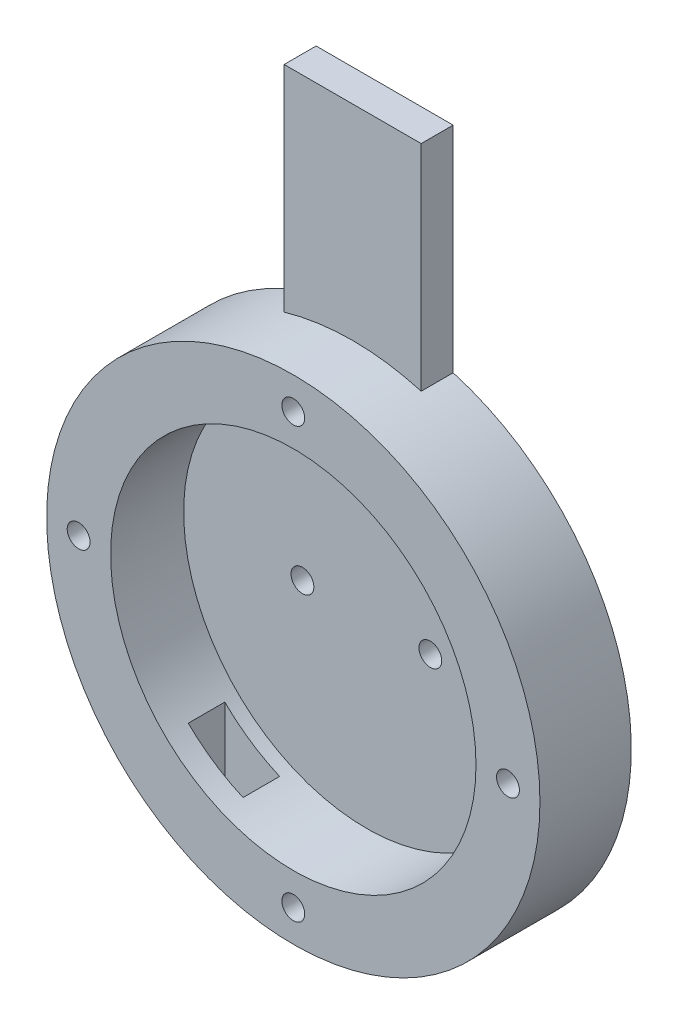
from build123d import *

# Parameters (mm, degrees)
SKETCH1_R               = 27
SKETCH1_R_2             = 1.25
SKETCH1_R_3             = 20
BOSS_EXTRUDE1_DEPTH     = 10
SKETCH3_R               = 20
SKETCH3_R_2             = 1.25
BOSS_EXTRUDE2_DEPTH     = 2
SKETCH5_W               = 15
SKETCH5_H               = 24.16646527
BOSS_EXTRUDE3_DEPTH     = 3.5
CUT_EXTRUDE1_REACH      = 59.191
CUT_EXTRUDE1_END_RADIUS = 27
SKETCH4_W               = 6
SKETCH4_H               = 4


with BuildPart() as part:
    # Sketch1 → Boss-Extrude1 (new body)
    with BuildSketch(Plane.XY):
        Circle(SKETCH1_R)
        with Locations((0, 23.5)):
            Circle(SKETCH1_R_2, mode=Mode.SUBTRACT)
        with Locations((23.5, 0)):
            Circle(SKETCH1_R_2, mode=Mode.SUBTRACT)
        with Locations((0, -23.5)):
            Circle(SKETCH1_R_2, mode=Mode.SUBTRACT)
        with Locations((-23.5, 0)):
            Circle(SKETCH1_R_2, mode=Mode.SUBTRACT)
        Circle(SKETCH1_R_3, mode=Mode.SUBTRACT)
    extrude(amount=BOSS_EXTRUDE1_DEPTH)

    # Sketch3 → Boss-Extrude2 (add)
    with BuildSketch(Plane.XY):
        Circle(SKETCH3_R)
        with Locations((-7, 0)):
            Circle(SKETCH3_R_2, mode=Mode.SUBTRACT)
        with Locations((7, 0)):
            Circle(SKETCH3_R_2, mode=Mode.SUBTRACT)
    extrude(amount=BOSS_EXTRUDE2_DEPTH)

    # Sketch5 → Boss-Extrude3 (add)
    with BuildSketch(Plane.XY):
        with Locations((0, 37.331237278)):
            Rectangle(SKETCH5_W, SKETCH5_H)
    extrude(amount=BOSS_EXTRUDE3_DEPTH)

    # Cut-Extrude1: up to this cylinder (the profile starts inside it)
    cut_extrude1_end = Plane(origin=(0, 0, 5.5), z_dir=(0, 0, -1)) * Cylinder(CUT_EXTRUDE1_END_RADIUS, 173.382, mode=Mode.PRIVATE)
    # Sketch4 → Cut-Extrude1 (cut, up to the surface)
    with BuildSketch(Plane(origin=(0, 0, 0), x_dir=(1, 0, 0), z_dir=(0, 1, 0)), mode=Mode.PRIVATE) as cut_extrude1_sk1:
        with Locations((-11, -5.5)):
            Rectangle(SKETCH4_W, SKETCH4_H)
    cut_extrude1_tool1 = extrude(cut_extrude1_sk1.sketch, amount=-CUT_EXTRUDE1_REACH, mode=Mode.PRIVATE) & cut_extrude1_end
    add(cut_extrude1_tool1.solids().sort_by_distance((-11, 0, 5.5))[0], mode=Mode.SUBTRACT)


solid = part.part
